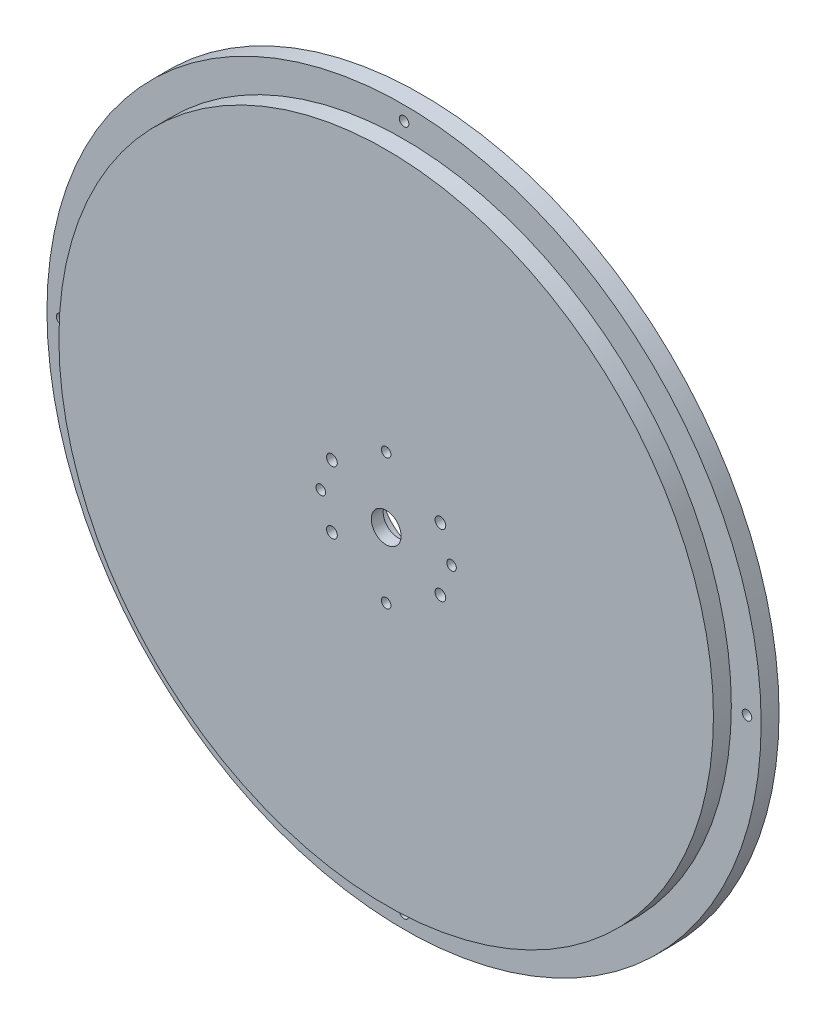
from build123d import *

# Parameters (mm, degrees)
SKETCH_1_R          = 109.75
EXTRUDE_1_DEPTH     = 12
SKETCH_2_R          = 119.75
EXTRUDE_2_DEPTH     = 6
SKETCH_3_R          = 1.6
CUT_EXTRUDE_1_DEPTH = 10
SKETCH_4_R          = 1.6
CUT_EXTRUDE_2_DEPTH = 20
SKETCH_4_5_R        = 1.6
CUT_EXTRUDE_3_DEPTH = 20
SKETCH_6_R          = 5
CUT_EXTRUDE_5_DEPTH = 20
SKETCH_7_R          = 1.8
CUT_EXTRUDE_8_DEPTH = 30
SKETCH_10_R         = 14
CUT_EXTRUDE_9_DEPTH = 8


with BuildPart() as part:
    # 草图1 → 凸台-拉伸1 (new body)
    with BuildSketch(Plane.XY):
        Circle(SKETCH_1_R)
    extrude(amount=EXTRUDE_1_DEPTH)

    # 草图2 → 凸台-拉伸2 (add)
    with BuildSketch(Plane.XY):
        Circle(SKETCH_2_R)
    extrude(amount=EXTRUDE_2_DEPTH)

    # 草图3 → 切除-拉伸1 (cut)
    with BuildSketch(Plane.XY):
        with Locations((-115, 0)):
            Circle(SKETCH_3_R)
        with Locations((115, 0)):
            Circle(SKETCH_3_R)
        with Locations((0, -115)):
            Circle(SKETCH_3_R)
        with Locations((0, 115)):
            Circle(SKETCH_3_R)
    extrude(amount=CUT_EXTRUDE_1_DEPTH, mode=Mode.SUBTRACT)

    # 草图4 → 切除-拉伸2 (cut)
    with BuildSketch(Plane(origin=(0, 0, 0), x_dir=(-1, 0, 0), z_dir=(0, 0, -1))):
        with Locations((0, -21.9203)):
            Circle(SKETCH_4_R)
    extrude(amount=-CUT_EXTRUDE_2_DEPTH, mode=Mode.SUBTRACT)

    # 草图4<5> → 切除-拉伸3 (cut)
    with BuildSketch(Plane(origin=(0, 0, 0), x_dir=(-1, 0, 0), z_dir=(0, 0, -1))):
        with Locations((-21.9203, 0)):
            Circle(SKETCH_4_5_R)
        with Locations((0, 21.9203)):
            Circle(SKETCH_4_5_R)
        with Locations((21.9203, 0)):
            Circle(SKETCH_4_5_R)
        with Locations((0, -21.9203)):
            Circle(SKETCH_4_5_R)
    extrude(amount=-CUT_EXTRUDE_3_DEPTH, mode=Mode.SUBTRACT)

    # 草图6 → 切除-拉伸5 (cut)
    with BuildSketch(Plane(origin=(0, 0, 0), x_dir=(-1, 0, 0), z_dir=(0, 0, -1))):
        Circle(SKETCH_6_R)
    extrude(amount=-CUT_EXTRUDE_5_DEPTH, mode=Mode.SUBTRACT)

    # 草图7 → 切除-拉伸8 (cut)
    with BuildSketch(Plane(origin=(0, 0, 0), x_dir=(-1, 0, 0), z_dir=(0, 0, -1))):
        with Locations((-18.186533479, 10.5)):
            Circle(SKETCH_7_R)
        with Locations((18.186533479, 10.5)):
            Circle(SKETCH_7_R)
        with Locations((18.186533479, -10.5)):
            Circle(SKETCH_7_R)
        with Locations((-18.186533479, -10.5)):
            Circle(SKETCH_7_R)
    extrude(amount=-CUT_EXTRUDE_8_DEPTH, mode=Mode.SUBTRACT)

    # 草图10 → 切除-拉伸9 (cut)
    with BuildSketch(Plane(origin=(0, 0, 0), x_dir=(-1, 0, 0), z_dir=(0, 0, -1))):
        Circle(SKETCH_10_R)
    extrude(amount=-CUT_EXTRUDE_9_DEPTH, mode=Mode.SUBTRACT)


solid = part.part
